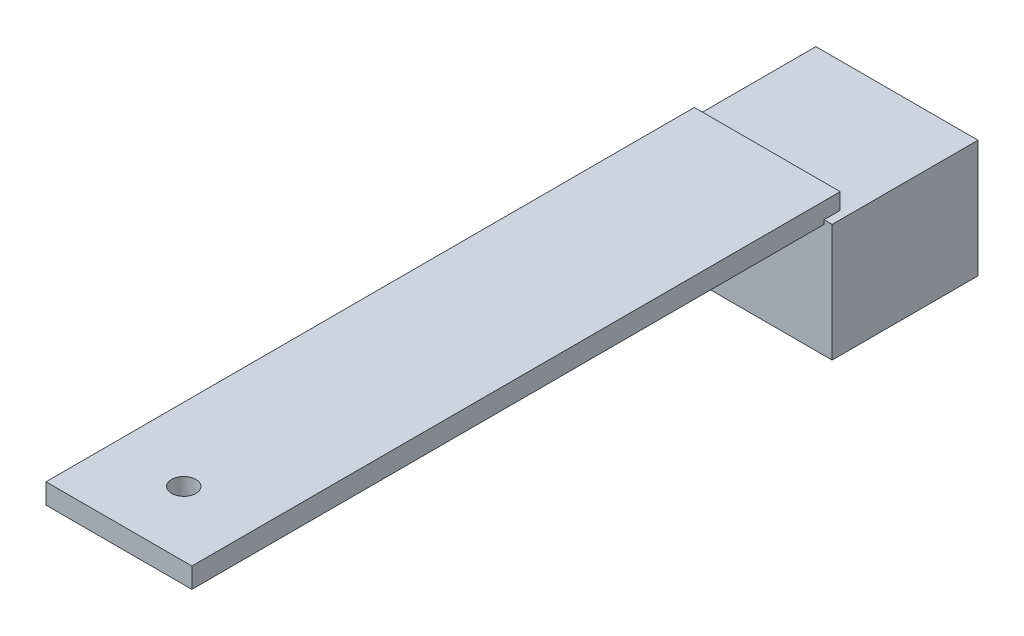
from build123d import *

# Parameters (mm, degrees)
S_BOX1_W     = 18
S_BOX1_H     = 2.5
BOSS_1_DEPTH = 80
S_BOX2_W     = 20
S_BOX2_H     = 14.5
BOSS_2_DEPTH = 18
S_HOLE3_R    = 1.5
HOLE_3_DEPTH = 2.7


with BuildPart() as part:
    # S_box1 → Boss_1 (new body)
    with BuildSketch(Plane.XY.offset(-72)):
        with Locations((0, 19.45)):
            Rectangle(S_BOX1_W, S_BOX1_H)
    extrude(amount=BOSS_1_DEPTH)

    # S_box2 → Boss_2 (add)
    with BuildSketch(Plane.XY.offset(-88)):
        with Locations((0, 11.45)):
            Rectangle(S_BOX2_W, S_BOX2_H)
    extrude(amount=BOSS_2_DEPTH)

    # S_hole3 → Hole_3 (cut)
    with BuildSketch(Plane(origin=(0, 18.1, 0), x_dir=(1, 0, 0), z_dir=(0, 1, 0))):
        with Locations(Location((0, 0, 0), (0, 0, 90))):
            Circle(S_HOLE3_R)
    extrude(amount=HOLE_3_DEPTH, mode=Mode.SUBTRACT)


solid = part.part
